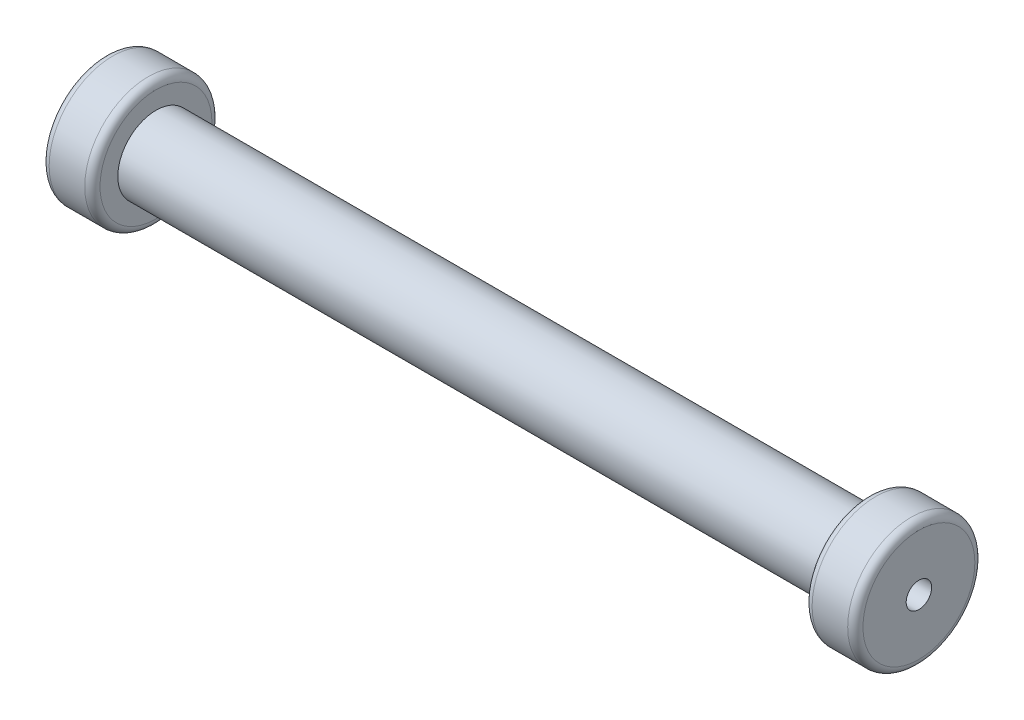
from build123d import *

# Parameters (mm, degrees)
FILLET1_R          = 3
SKETCH3_R          = 5
CUT_EXTRUDE1_DEPTH = 322.947200755


with BuildPart() as part:
    # Sketch2 → Revolve1 (revolve)
    with BuildSketch(Plane(origin=(0, 0, 0), x_dir=(1, 0, 0), z_dir=(0, 1, 0))):
        Polygon((-160, 0), (160, 0), (160, -25), (140, -25), (140, -15), (-140, -15), (-140, -25), (-160, -25), align=None)
    revolve(axis=Axis((-179.615783414, 0, 0), (1, 0, 0)))

    # Fillet1
    fillet1_edges = [part.edges().sort_by_distance(p)[0] for p in [
        (140, 0, -25),
        (160, 0, -25),
        (-160, 0, -25),
        (-140, 0, -25),
    ]]
    fillet(fillet1_edges, radius=FILLET1_R)

    # Sketch3 → Cut-Extrude1 (cut, through all)
    with BuildSketch(Plane(origin=(160, 0, 0), x_dir=(0, 0, -1), z_dir=(1, 0, 0))):
        Circle(SKETCH3_R)
    extrude(amount=-CUT_EXTRUDE1_DEPTH, mode=Mode.SUBTRACT)


solid = part.part
